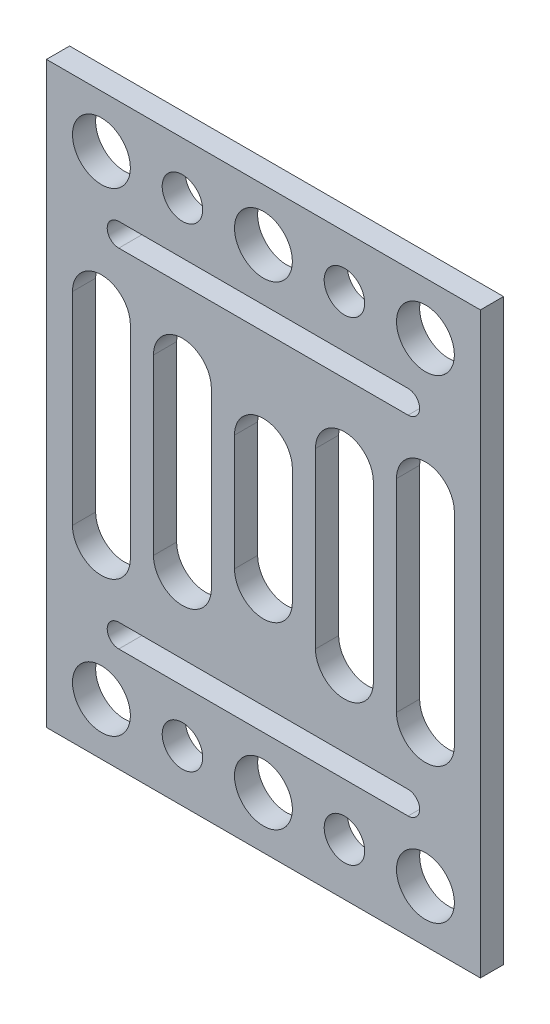
from build123d import *

# Parameters (mm, degrees)
SKIZZE1_W                       = 75
SKIZZE1_H                       = 100
GRUNDPLATTE_DEPTH               = 4
SKIZZE2_R                       = 5
SKIZZE2_R_2                     = 3.5
SCHNITT_LINEAR_AUSTRAGEN1_DEPTH = 63.627869196


with BuildPart() as part:
    # Skizze1 → Grundplatte (new body)
    with BuildSketch(Plane.XY):
        Rectangle(SKIZZE1_W, SKIZZE1_H)
        with BuildLine():
            Line((25, 28), (-25, 28))
            ThreePointArc((-25, 28), (-27, 30), (-25, 32))
            Line((-25, 32), (25, 32))
            ThreePointArc((25, 32), (27, 30), (25, 28))
        make_face(mode=Mode.SUBTRACT)
        with BuildLine():
            Line((25, -28), (-25, -28))
            ThreePointArc((-25, -28), (-27, -30), (-25, -32))
            Line((-25, -32), (25, -32))
            ThreePointArc((25, -32), (27, -30), (25, -28))
        make_face(mode=Mode.SUBTRACT)
    extrude(amount=GRUNDPLATTE_DEPTH)

    # Skizze2 → Schnitt-Linear austragen1 (cut, through all)
    with BuildSketch(Plane.XY.offset(4)):
        with Locations((-28, 41)):
            Circle(SKIZZE2_R)
        with Locations((0, 41)):
            Circle(SKIZZE2_R)
        with Locations((28, 41)):
            Circle(SKIZZE2_R)
        with Locations((-14, 41)):
            Circle(SKIZZE2_R_2)
        with Locations((14, 41)):
            Circle(SKIZZE2_R_2)
        with Locations(Location((14, -41, 0), (0, 0, 180))):
            Circle(SKIZZE2_R_2)
        with Locations(Location((-14, -41, 0), (0, 0, 180))):
            Circle(SKIZZE2_R_2)
        with Locations(Location((28, -41, 0), (0, 0, 180))):
            Circle(SKIZZE2_R)
        with Locations(Location((0, -41, 0), (0, 0, 180))):
            Circle(SKIZZE2_R)
        with Locations(Location((-28, -41, 0), (0, 0, 180))):
            Circle(SKIZZE2_R)
        with BuildLine():
            Line((-33, -17.5), (-33, 17.5))
            ThreePointArc((-33, 17.5), (-28, 22.5), (-23, 17.5))
            Line((-23, 17.5), (-23, -17.5))
            ThreePointArc((-23, -17.5), (-28, -22.5), (-33, -17.5))
        make_face()
        with BuildLine():
            Line((5, 10), (5, -10))
            ThreePointArc((5, -10), (0, -15), (-5, -10))
            Line((-5, -10), (-5, 10))
            ThreePointArc((-5, 10), (0, 15), (5, 10))
        make_face()
        with BuildLine():
            Line((-9, 15), (-9, -15))
            ThreePointArc((-9, -15), (-14, -20), (-19, -15))
            Line((-19, -15), (-19, 15))
            ThreePointArc((-19, 15), (-14, 20), (-9, 15))
        make_face()
        with BuildLine():
            Line((9, 15), (9, -15))
            ThreePointArc((9, -15), (14, -20), (19, -15))
            Line((19, -15), (19, 15))
            ThreePointArc((19, 15), (14, 20), (9, 15))
        make_face()
        with BuildLine():
            Line((33, -17.5), (33, 17.5))
            ThreePointArc((33, 17.5), (28, 22.5), (23, 17.5))
            Line((23, 17.5), (23, -17.5))
            ThreePointArc((23, -17.5), (28, -22.5), (33, -17.5))
        make_face()
    extrude(amount=-SCHNITT_LINEAR_AUSTRAGEN1_DEPTH, mode=Mode.SUBTRACT)


solid = part.part
